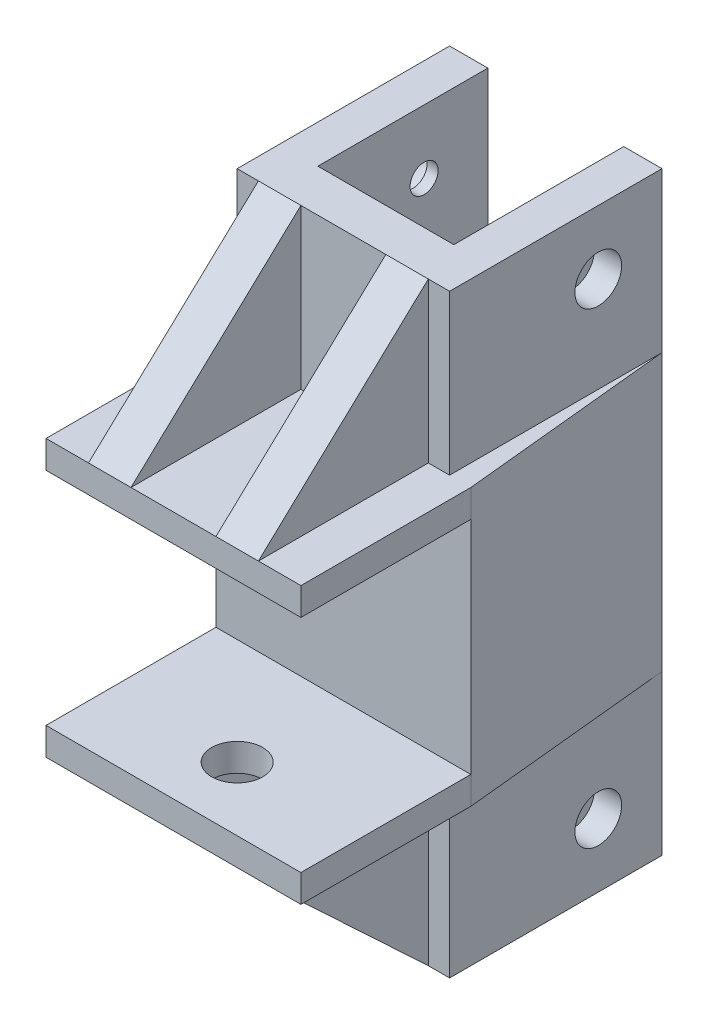
from build123d import *

# Parameters (mm, degrees)
SKETCH1_W               = 40
SKETCH1_H               = 65
BOSS_EXTRUDE1_DEPTH     = 30
CUT_EXTRUDE1_DEPTH      = 49.541219597
CUT_EXTRUDE1_DEPTH_BACK = 49.541219597
SKETCH2_W               = 40
SKETCH2_H               = 52
SKETCH3_R               = 6
CUT_EXTRUDE2_DEPTH      = 32.5
SKETCH4_W               = 50
SKETCH4_H               = 140
BOSS_EXTRUDE2_DEPTH     = 50
BOSS_EXTRUDE3_DEPTH     = 20
CUT_EXTRUDE3_DEPTH      = 10
CUT_EXTRUDE4_DEPTH      = 104.440804328
CUT_EXTRUDE4_DEPTH_BACK = 104.440804328
SKETCH10_W              = 32
SKETCH10_H              = 40
CUT_EXTRUDE5_DEPTH      = 104.440804328
CUT_EXTRUDE5_DEPTH_BACK = 104.440804328
SKETCH11_R              = 3.3
CUT_EXTRUDE6_START      = -6.4
SKETCH12_R              = 5.5
CUT_EXTRUDE6_DEPTH      = 120.647516529
SKETCH13_R              = 6
CUT_EXTRUDE7_DEPTH      = 3
BOSS_EXTRUDE4_START     = -32.5
BOSS_EXTRUDE4_DEPTH     = 65


with BuildPart() as part:
    # Sketch1 → Boss-Extrude1 (new, symmetric)
    with BuildSketch(Plane(origin=(0, 0, 0), x_dir=(0, 0, -1), z_dir=(1, 0, 0))):
        Rectangle(SKETCH1_W, SKETCH1_H)
    extrude(amount=BOSS_EXTRUDE1_DEPTH, both=True)

    # Sketch2 → Cut-Extrude1 (cut, two sides: drawn at the far end of the back side and taken through both)
    with BuildSketch(Plane(origin=(0, 0, 0), x_dir=(0, 0, -1), z_dir=(1, 0, 0)).offset(-CUT_EXTRUDE1_DEPTH_BACK)):
        Rectangle(SKETCH2_W, SKETCH2_H)
    extrude(amount=CUT_EXTRUDE1_DEPTH + CUT_EXTRUDE1_DEPTH_BACK, mode=Mode.SUBTRACT)


with BuildPart() as cut_extrude1_piece_1:
    # of the separate pieces the step leaves, piece 1, a body of its own (cut_extrude1_pieces)
    add(part.part.solids().sort_by_distance((-30, -32.5, 20))[0])

    # Sketch3 → Cut-Extrude2 (cut)
    with BuildSketch(Plane(origin=(0, 0, 0), x_dir=(1, 0, 0), z_dir=(0, 1, 0))):
        with Locations(Location((0, -5, 0), (0, 0, 270))):
            Circle(SKETCH3_R)
    extrude(amount=-CUT_EXTRUDE2_DEPTH, mode=Mode.SUBTRACT)

    # Sketch8 → Boss-Extrude3 (add, symmetric)
    with BuildSketch(Plane(origin=(0, 0, 0), x_dir=(0, 0, -1), z_dir=(1, 0, 0))):
        Polygon((20, 70), (-20, 32.5), (20, 32.5), align=None)
        Polygon((20, -32.5), (20, -70), (-20, -32.5), align=None)
    extrude(amount=BOSS_EXTRUDE3_DEPTH, both=True)


with BuildPart() as cut_extrude1_piece_2:
    # of the separate pieces the step leaves, piece 2, a body of its own (cut_extrude1_pieces)
    add(part.part.solids().sort_by_distance((-30, 32.5, 20))[0])

    # Sketch4 → Boss-Extrude2 (add)
    with BuildSketch(Plane(origin=(0, 0, -20), x_dir=(-1, 0, 0), z_dir=(0, 0, -1))):
        Rectangle(SKETCH4_W, SKETCH4_H)
    extrude(amount=BOSS_EXTRUDE2_DEPTH)

    # Sketch10 → Cut-Extrude4 (cut, two sides: drawn at the far end of the back side and taken through both)
    with BuildSketch(Plane(origin=(0, 0, 0), x_dir=(1, 0, 0), z_dir=(0, 1, 0)).offset(-CUT_EXTRUDE4_DEPTH_BACK)):
        with Locations((0, 50)):
            Rectangle(SKETCH10_W, SKETCH10_H)
    extrude(amount=CUT_EXTRUDE4_DEPTH + CUT_EXTRUDE4_DEPTH_BACK, mode=Mode.SUBTRACT)

    # Sketch11 → Cut-Extrude5 (cut, two sides: drawn at the far end of the back side and taken through both)
    with BuildSketch(Plane(origin=(0, 0, 0), x_dir=(0, 0, -1), z_dir=(1, 0, 0)).offset(-CUT_EXTRUDE5_DEPTH_BACK)):
        with Locations((55, 55)):
            Circle(SKETCH11_R)
        with Locations((55, -55)):
            Circle(SKETCH11_R)
    extrude(amount=CUT_EXTRUDE5_DEPTH + CUT_EXTRUDE5_DEPTH_BACK, mode=Mode.SUBTRACT)

    # Sketch12 → Cut-Extrude6 (cut)
    with BuildSketch(Plane(origin=(25, 0, 0), x_dir=(0, 0, -1), z_dir=(1, 0, 0)).offset(CUT_EXTRUDE6_START)):
        with Locations(Location((55, 55, 0), (0, 0, 180))):
            Circle(SKETCH12_R)
        with Locations(Location((55, -55, 0), (0, 0, 180))):
            Circle(SKETCH12_R)
    cut_extrude6 = extrude(amount=CUT_EXTRUDE6_DEPTH, mode=Mode.SUBTRACT)

    # Mirror1: Cut-Extrude6 across plane
    add(cut_extrude6.mirror(Plane(origin=(0, 0, 0), x_dir=(0, 0, 1), z_dir=(1, 0, 0))), mode=Mode.SUBTRACT)

    # Sketch13 → Cut-Extrude7 (cut)
    with BuildSketch(Plane(origin=(0, 26, 0), x_dir=(1, 0, 0), z_dir=(0, 1, 0))):
        with Locations(Location((0, -5, 0), (0, 0, 270))):
            Circle(SKETCH13_R)
    extrude(amount=CUT_EXTRUDE7_DEPTH, mode=Mode.SUBTRACT)



with BuildPart() as boss_extrude3_piece_1:
    # of the separate pieces the step leaves, piece 1, a body of its own (boss_extrude3_pieces)
    add(cut_extrude1_piece_1.part.solids().sort_by_distance((-20, -32.5, 20))[0])


with BuildPart() as boss_extrude3_piece_2:
    # of the separate pieces the step leaves, piece 2, a body of its own (boss_extrude3_pieces)
    add(cut_extrude1_piece_1.part.solids().sort_by_distance((-20, 70, -20))[0])


with BuildPart() as cut_extrude3_tool:
    # Sketch9 → Cut-Extrude3 (new, symmetric)
    with BuildSketch(Plane(origin=(0, 0, 0), x_dir=(0, 0, -1), z_dir=(1, 0, 0))):
        Polygon((20, 70), (-20, 32.5), (20, 32.5), align=None)
        Polygon((-20, -32.5), (20, -70), (20, -32.5), align=None)
    extrude(amount=CUT_EXTRUDE3_DEPTH, both=True)


with BuildPart() as boss_extrude3_piece_1_1:
    add(boss_extrude3_piece_1.part)

    # Cut-Extrude3: cut by cut_extrude3_tool
    add(cut_extrude3_tool.part, mode=Mode.SUBTRACT)


with BuildPart() as boss_extrude3_piece_2_1:
    add(boss_extrude3_piece_2.part)

    # Cut-Extrude3: cut by cut_extrude3_tool
    add(cut_extrude3_tool.part, mode=Mode.SUBTRACT)


with BuildPart() as cut_extrude1_piece_2_1:
    add(cut_extrude1_piece_2.part)

    add(boss_extrude3_piece_1_1.part)  # Boss-Extrude4 merges Boss-Extrude3 piece 1
    # Sketch15 → Boss-Extrude4 (add)
    with BuildSketch(Plane(origin=(0, 0, 0), x_dir=(1, 0, 0), z_dir=(0, 1, 0)).offset(BOSS_EXTRUDE4_START)):
        Polygon((30, 20), (25, 70), (25, 20), align=None)
        Polygon((-25, 20), (-30, 20), (-25, 70), align=None)
    extrude(amount=BOSS_EXTRUDE4_DEPTH)


solid = Compound([boss_extrude3_piece_2_1.part, cut_extrude1_piece_2_1.part])
